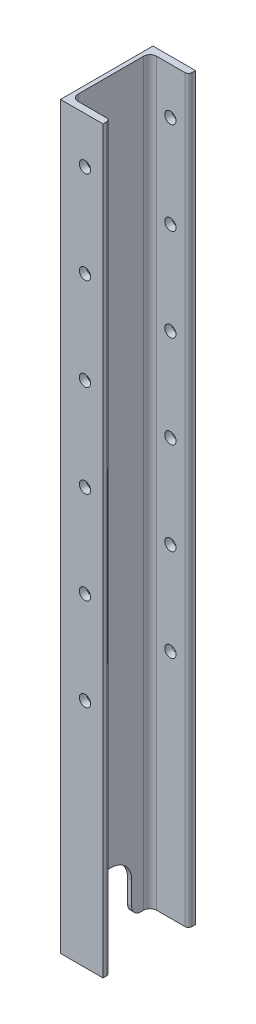
from build123d import *

# Parameters (mm, degrees)
EXTRUDE_1_DEPTH          = 800
CUT_EXTRUDE_1_DEPTH      = 803.87981666
CUT_EXTRUDE_1_DEPTH_BACK = 803.87981666
FILLET_1_R               = 10
CUT_EXTRUDE_2_DEPTH      = 808.536996057
CUT_EXTRUDE_2_DEPTH_BACK = 808.536996057
SKETCH_3_R               = 6.1


with BuildPart() as part:
    # Эскиз1 → Бобышка-Вытянуть1 (new body)
    with BuildSketch(Plane(origin=(0, 0, 0), x_dir=(1, 0, 0), z_dir=(0, 1, 0))):
        with BuildLine():
            Line((0, -50), (0, 50))
            Line((0, 50), (46, 50))
            Line((46, 50), (46, 46.4))
            ThreePointArc((46, 46.4), (44.828427125, 43.571572875), (42, 42.4))
            Line((42, 42.4), (11.5, 42.4))
            ThreePointArc((11.5, 42.4), (6.550252532, 40.349747468), (4.5, 35.4))
            Line((4.5, 35.4), (4.5, -35.4))
            ThreePointArc((4.5, -35.4), (6.550252532, -40.349747468), (11.5, -42.4))
            Line((11.5, -42.4), (42, -42.4))
            ThreePointArc((42, -42.4), (44.828427125, -43.571572875), (46, -46.4))
            Line((46, -46.4), (46, -50))
            Line((46, -50), (0, -50))
        make_face()
    extrude(amount=EXTRUDE_1_DEPTH)

    # Эскиз2 → Вырез-Вытянуть1 (cut, two sides: drawn at the far end of the back side and taken through both)
    with BuildSketch(Plane.ZY.offset(-CUT_EXTRUDE_1_DEPTH_BACK)):
        with BuildLine():
            Line((-22.5, 35), (-22.5, 0))
            Line((-22.5, 0), (22.5, 0))
            Line((22.5, 0), (22.5, 35))
            ThreePointArc((22.5, 35), (0, 57.5), (-22.5, 35))
        make_face()
    extrude(amount=CUT_EXTRUDE_1_DEPTH + CUT_EXTRUDE_1_DEPTH_BACK, mode=Mode.SUBTRACT)

    # Скругление1
    fillet_1_edges = [part.edges().sort_by_distance(p)[0] for p in [
        (2.25, 0, -22.5),
        (2.25, 0, 22.5),
    ]]
    fillet(fillet_1_edges, radius=FILLET_1_R)

    # Эскиз3 → Вырез-Вытянуть2 (cut, two sides: drawn at the far end of the back side and taken through both)
    with BuildSketch(Plane(origin=(0, 0, -50), x_dir=(-1, 0, 0), z_dir=(0, 0, -1)).offset(-CUT_EXTRUDE_2_DEPTH_BACK)):
        with Locations((-26.44, 750)):
            Circle(SKETCH_3_R)
        with Locations((-26.44, 650)):
            Circle(SKETCH_3_R)
        with Locations((-26.44, 550)):
            Circle(SKETCH_3_R)
        with Locations((-26.44, 450)):
            Circle(SKETCH_3_R)
        with Locations((-26.44, 350)):
            Circle(SKETCH_3_R)
        with Locations((-26.44, 250)):
            Circle(SKETCH_3_R)
    extrude(amount=CUT_EXTRUDE_2_DEPTH + CUT_EXTRUDE_2_DEPTH_BACK, mode=Mode.SUBTRACT)


solid = part.part
